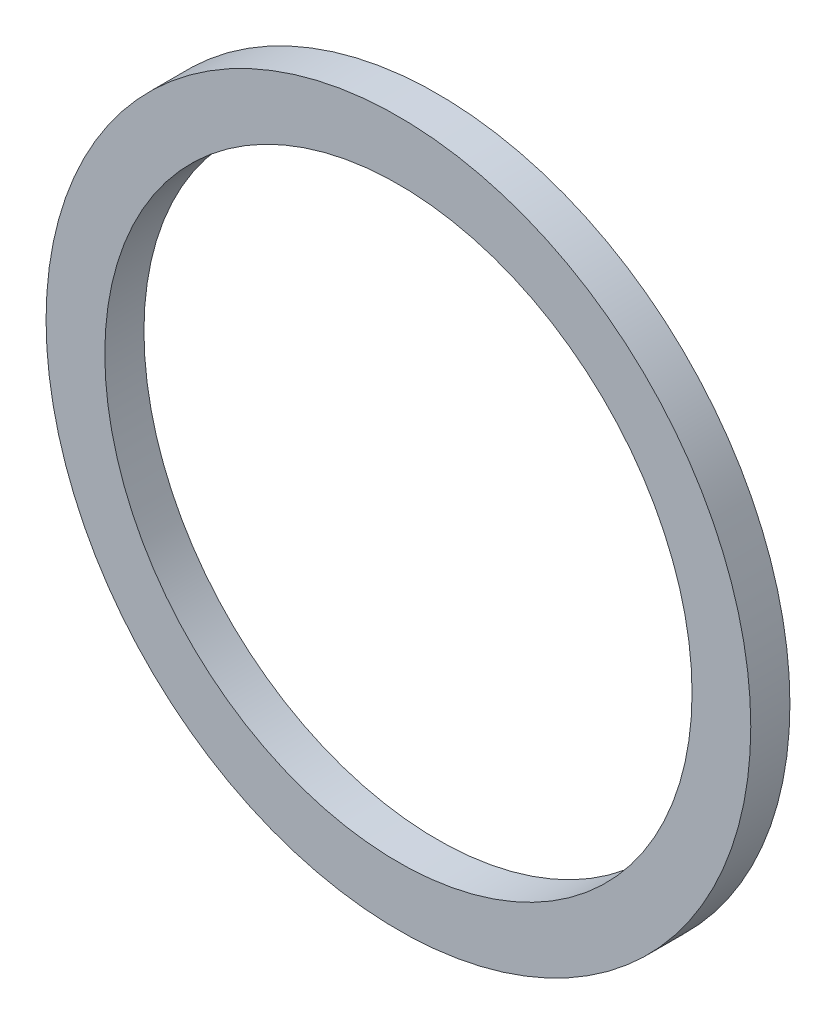
from build123d import *

# Parameters (mm, degrees)
SKETCH_1_R      = 1.8
SKETCH_1_R_2    = 1.5
EXTRUDE_1_DEPTH = 0.2


with BuildPart() as part:
    # 草图1 → 凸台-拉伸1 (new body)
    with BuildSketch(Plane.XY):
        Circle(SKETCH_1_R)
        Circle(SKETCH_1_R_2, mode=Mode.SUBTRACT)
    extrude(amount=EXTRUDE_1_DEPTH)


solid = part.part
